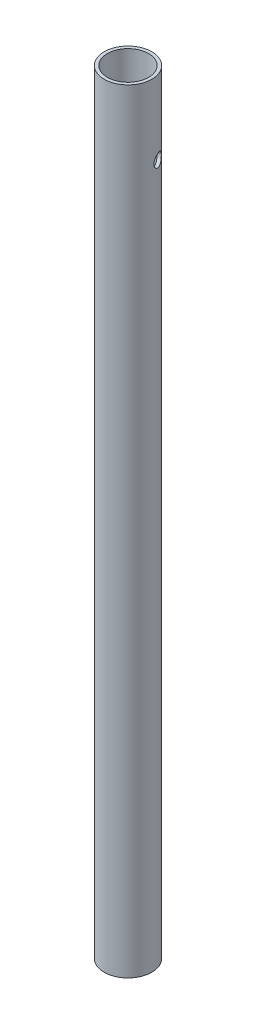
from build123d import *

# Parameters (mm, degrees)
SKETCH_1_R          = 15
SKETCH_1_R_2        = 13
EXTRUDE_1_DEPTH     = 487
SKETCH_5_R          = 4
CUT_EXTRUDE_1_DEPTH = 47.5


with BuildPart() as part:
    # Эскиз1 → Вытянуть1 (new body)
    with BuildSketch(Plane(origin=(0, 0, 0), x_dir=(1, 0, 0), z_dir=(0, 1, 0))):
        with Locations(Location((0, 0, 0), (0, 0, 270))):
            Circle(SKETCH_1_R)
        with Locations(Location((0, 0, 0), (0, 0, 270))):
            Circle(SKETCH_1_R_2, mode=Mode.SUBTRACT)
    extrude(amount=EXTRUDE_1_DEPTH)

    # Эскиз5 → Вырез-Вытянуть1 (cut, symmetric)
    with BuildSketch(Plane(origin=(-19.177553223, 0, 7.243718229), x_dir=(0.353352108149494, 0, 0.9354903995585997), z_dir=(-0.9354903995585997, 0, 0.353352108149494))):
        with Locations((0, 440)):
            Circle(SKETCH_5_R)
    extrude(amount=CUT_EXTRUDE_1_DEPTH, both=True, mode=Mode.SUBTRACT)


solid = part.part
